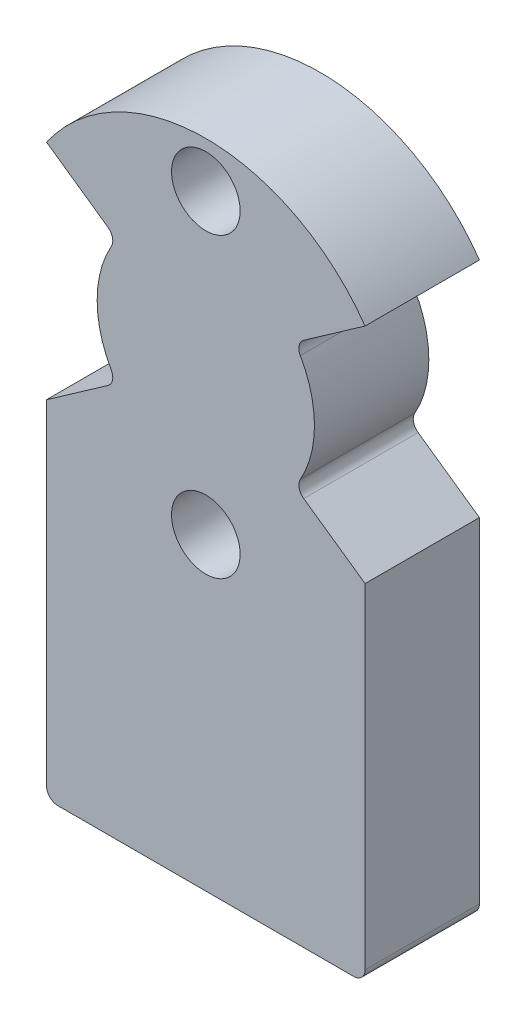
from build123d import *

# Parameters (mm, degrees)
SKETCH_1_R          = 8.5
EXTRUDE_1_DEPTH     = 5
SKETCH_2_R          = 1.5
CUT_EXTRUDE_1_DEPTH = 5
CUT_EXTRUDE_2_DEPTH = 14.019216566
EXTRUDE_2_DEPTH     = 5
FILLET_1_R          = 0.5
FILLET_2_R          = 0.5


with BuildPart() as part:
    # 草图1 → 凸台-拉伸1 (new body)
    with BuildSketch(Plane.XY):
        Circle(SKETCH_1_R)
    extrude(amount=EXTRUDE_1_DEPTH)

    # 草图2 → 切除-拉伸1 (cut)
    with BuildSketch(Plane.XY.offset(5)):
        with Locations((0, 6.5)):
            Circle(SKETCH_2_R)
        with Locations((0, -6.5)):
            Circle(SKETCH_2_R)
    extrude(amount=-CUT_EXTRUDE_1_DEPTH, mode=Mode.SUBTRACT)

    # 草图3 → 切除-拉伸2 (cut, through all)
    with BuildSketch(Plane(origin=(0, 0, 0), x_dir=(-1, 0, 0), z_dir=(0, 0, -1))):
        with BuildLine():
            ThreePointArc((3.89097221, 2.724488073), (4.75, 0), (3.89097221, -2.724488073))
            Line((3.89097221, -2.724488073), (6.962792376, -4.875399709))
            ThreePointArc((6.962792376, -4.875399709), (8.5, 0), (6.962792376, 4.875399709))
            Line((6.962792376, 4.875399709), (3.89097221, 2.724488073))
        make_face()
    cut_extrude_2 = extrude(amount=-CUT_EXTRUDE_2_DEPTH, mode=Mode.SUBTRACT)

    # 镜向1: 切除-拉伸2 across plane
    add(cut_extrude_2.mirror(Plane(origin=(0, 0, 0), x_dir=(0, 0, 1), z_dir=(1, 0, 0))), mode=Mode.SUBTRACT)


with BuildPart() as body_2:
    # 草图4 → 凸台-拉伸2 (new body)
    with BuildSketch(Plane(origin=(0, 0, 0), x_dir=(-1, 0, 0), z_dir=(0, 0, -1))):
        with BuildLine():
            ThreePointArc((6.962792376, -4.875399709), (0, -8.5), (-6.962792376, -4.875399709))
            Line((-6.962792376, -4.875399709), (-6.962792376, -20))
            Line((-6.962792376, -20), (6.962792376, -20))
            Line((6.962792376, -20), (6.962792376, -4.875399709))
        make_face()
    extrude(amount=-EXTRUDE_2_DEPTH)


with BuildPart() as part_1:
    add(part.part)

    # Combine 1: union body 2
    add(body_2.part)

    # 圆角1
    fillet_1_edges = [part_1.edges().sort_by_distance(p)[0] for p in [
        (-3.89097221, -2.724488073, 2.5),
        (-3.89097221, 2.724488073, 2.5),
        (3.89097221, 2.724488073, 2.5),
        (3.89097221, -2.724488073, 2.5),
    ]]
    fillet(fillet_1_edges, radius=FILLET_1_R)

    # 圆角2
    fillet_2_edges = [part_1.edges().sort_by_distance(p)[0] for p in [
        (6.962792376, -20, 2.5),
        (-6.962792376, -20, 2.5),
    ]]
    fillet(fillet_2_edges, radius=FILLET_2_R)


solid = part_1.part
